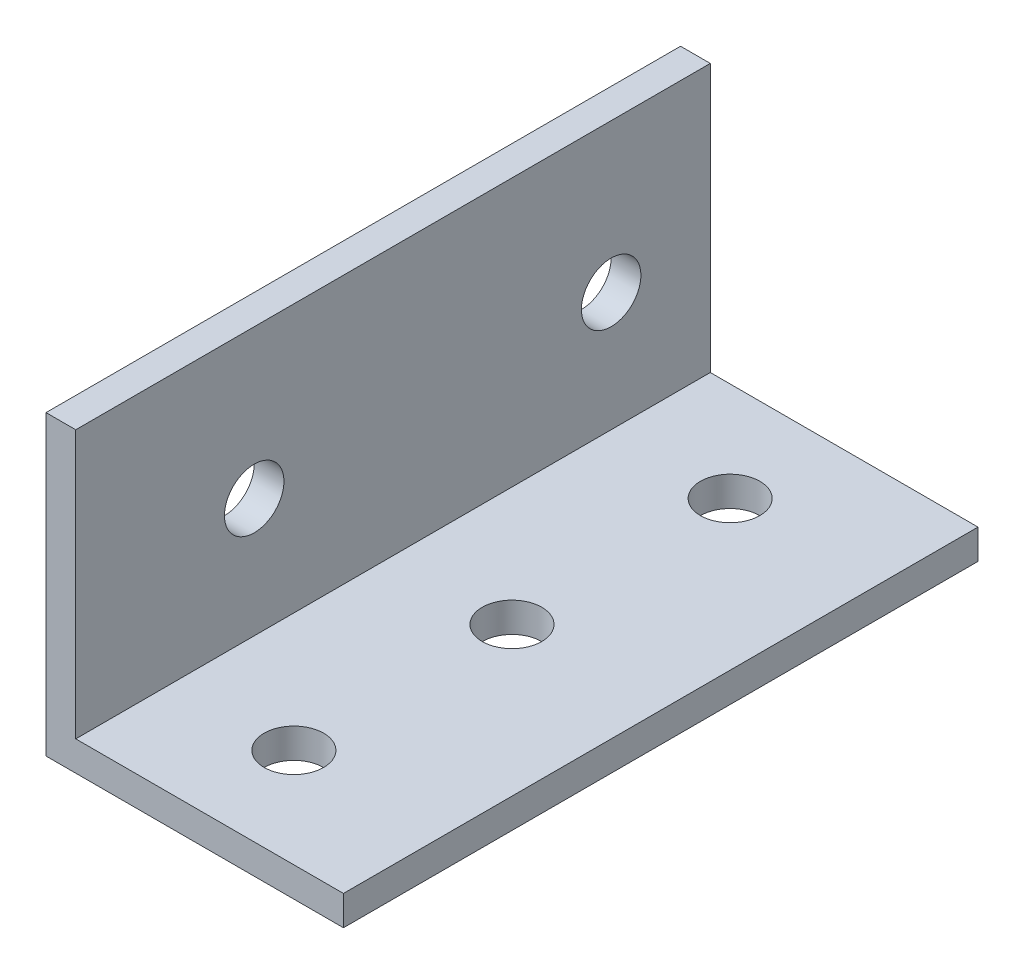
from build123d import *

# Parameters (mm, degrees)
EXTRUSION1_DEPTH = 32
ESQUISSE2_R      = 1.5
EXTRUSION2_DEPTH = 25
ESQUISSE3_R      = 1.5
EXTRUSION3_DEPTH = 25


with BuildPart() as part:
    # Esquisse1 → Extrusion1 (new body)
    with BuildSketch(Plane.XY):
        Polygon((-12.537924369, 4.331190223), (-12.537924369, -10.668809777), (2.462075631, -10.668809777), (2.462075631, -9.168809777), (-11.037924369, -9.168809777), (-11.037924369, 4.331190223), align=None)
    extrude(amount=EXTRUSION1_DEPTH)

    # Esquisse2 → Extrusion2 (cut)
    with BuildSketch(Plane.ZY.offset(12.537924369)):
        with Locations(Location((23, -3.168809777, 0), (0, 0, 270))):
            Circle(ESQUISSE2_R)
        with Locations(Location((5, -3.168809777, 0), (0, 0, 270))):
            Circle(ESQUISSE2_R)
    extrude(amount=-EXTRUSION2_DEPTH, mode=Mode.SUBTRACT)

    # Esquisse3 → Extrusion3 (cut)
    with BuildSketch(Plane.XZ.offset(10.668809777)):
        with Locations(Location((-5.037924369, 5, 0), (0, 0, 270))):
            Circle(ESQUISSE3_R)
        with Locations(Location((-5.037924369, 27, 0), (0, 0, 270))):
            Circle(ESQUISSE3_R)
        with Locations(Location((-5.037924369, 16, 0), (0, 0, 270))):
            Circle(ESQUISSE3_R)
    extrude(amount=-EXTRUSION3_DEPTH, mode=Mode.SUBTRACT)


solid = part.part
